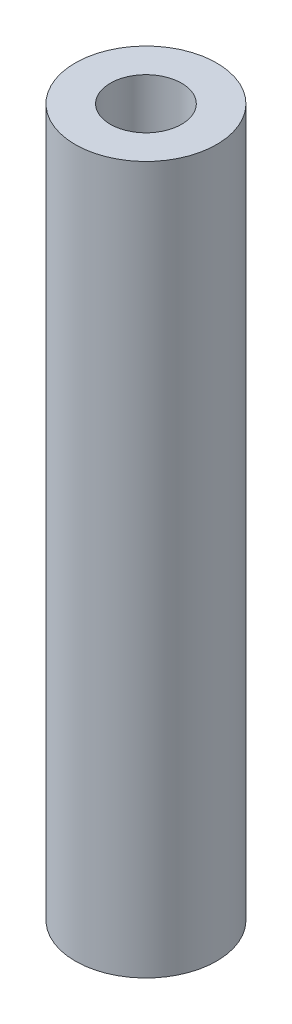
from build123d import *

# Parameters (mm, degrees)
SKETCH1_R           = 6.35
SKETCH1_R_2         = 3.2004
BOSS_EXTRUDE1_DEPTH = 63.5


with BuildPart() as part:
    # Sketch1 → Boss-Extrude1 (new body)
    with BuildSketch(Plane(origin=(0, 0, 0), x_dir=(1, 0, 0), z_dir=(0, 1, 0))):
        with Locations(Location((0, 0, 0), (0, 0, 270))):
            Circle(SKETCH1_R)
        with Locations(Location((0, 0, 0), (0, 0, 270))):
            Circle(SKETCH1_R_2, mode=Mode.SUBTRACT)
    extrude(amount=BOSS_EXTRUDE1_DEPTH)


solid = part.part
